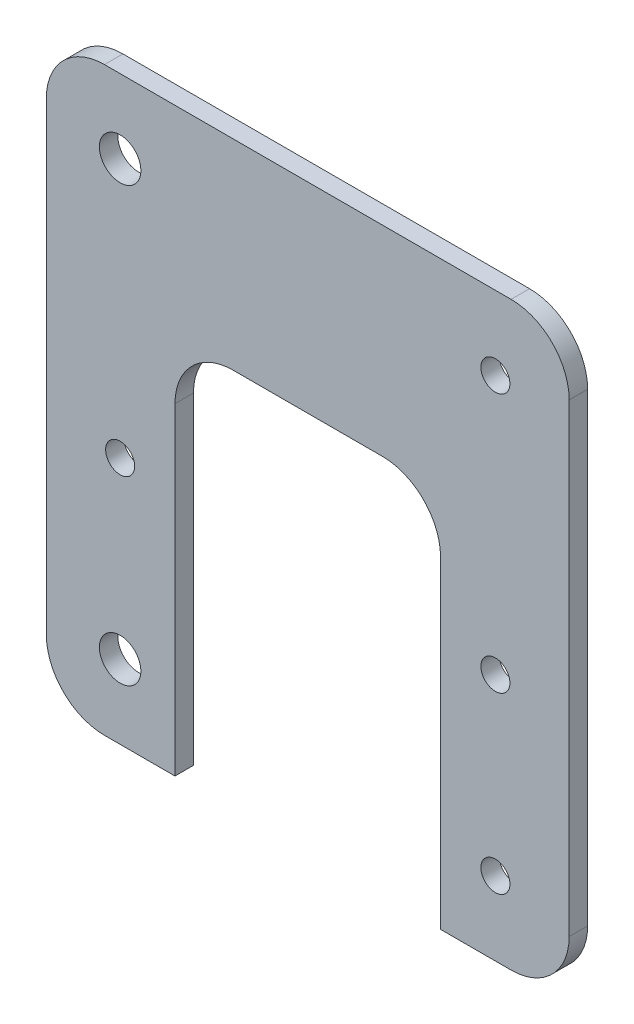
from build123d import *

# Parameters (mm, degrees)
BOSS_EXTRUDE1_START = 19.16
SKETCH1_W           = 90
SKETCH1_H           = 100
SKETCH1_R           = 2.5
SKETCH1_R_2         = 3.57
BOSS_EXTRUDE1_DEPTH = 3.18
SKETCH2_W           = 45.72
SKETCH2_H           = 65.511870912
CUT_EXTRUDE1_DEPTH  = 72.134467033
FILLET1_R           = 10


with BuildPart() as part:
    # Sketch1 → Boss-Extrude1 (new body)
    with BuildSketch(Plane.XY.offset(BOSS_EXTRUDE1_START)):
        with Locations((0, -5)):
            Rectangle(SKETCH1_W, SKETCH1_H)
        with Locations((32.3, -12.3)):
            Circle(SKETCH1_R, mode=Mode.SUBTRACT)
        with Locations((32.3, -42.3)):
            Circle(SKETCH1_R, mode=Mode.SUBTRACT)
        with Locations((-32.3, -42.3)):
            Circle(SKETCH1_R_2, mode=Mode.SUBTRACT)
        with Locations((-32.3, -12.3)):
            Circle(SKETCH1_R, mode=Mode.SUBTRACT)
        with Locations((-32.3, 32.3)):
            Circle(SKETCH1_R_2, mode=Mode.SUBTRACT)
        with Locations((32.3, 32.3)):
            Circle(SKETCH1_R, mode=Mode.SUBTRACT)
    extrude(amount=-BOSS_EXTRUDE1_DEPTH)

    # Sketch2 → Cut-Extrude1 (cut, through all)
    with BuildSketch(Plane(origin=(0, 0, 15.98), x_dir=(-1, 0, 0), z_dir=(0, 0, -1))):
        with Locations((0, -22.244064544)):
            Rectangle(SKETCH2_W, SKETCH2_H)
    extrude(amount=-CUT_EXTRUDE1_DEPTH, mode=Mode.SUBTRACT)

    # Fillet1
    fillet1_edges = [part.edges().sort_by_distance(p)[0] for p in [
        (22.86, 10.511870912, 17.57),
        (-22.86, 10.511870912, 17.57),
        (-45, 45, 17.57),
        (45, 45, 17.57),
        (45, -55, 17.57),
        (-45, -55, 17.57),
    ]]
    fillet(fillet1_edges, radius=FILLET1_R)


solid = part.part
